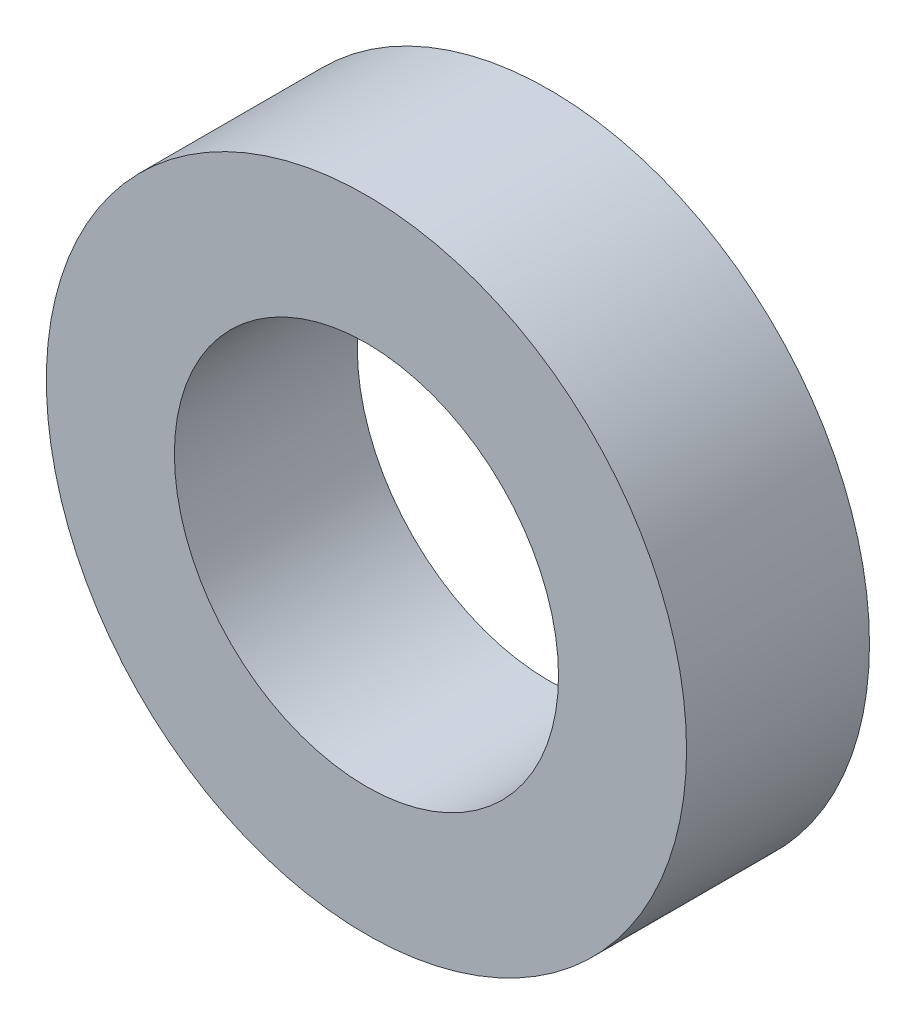
from build123d import *

# Parameters (mm, degrees)
SKETCH_1_R      = 3.5
SKETCH_1_R_2    = 2.1
EXTRUDE_1_DEPTH = 2


with BuildPart() as part:
    # 草图1 → 凸台-拉伸1 (new body)
    with BuildSketch(Plane.XY):
        Circle(SKETCH_1_R)
        Circle(SKETCH_1_R_2, mode=Mode.SUBTRACT)
    extrude(amount=EXTRUDE_1_DEPTH)


solid = part.part
